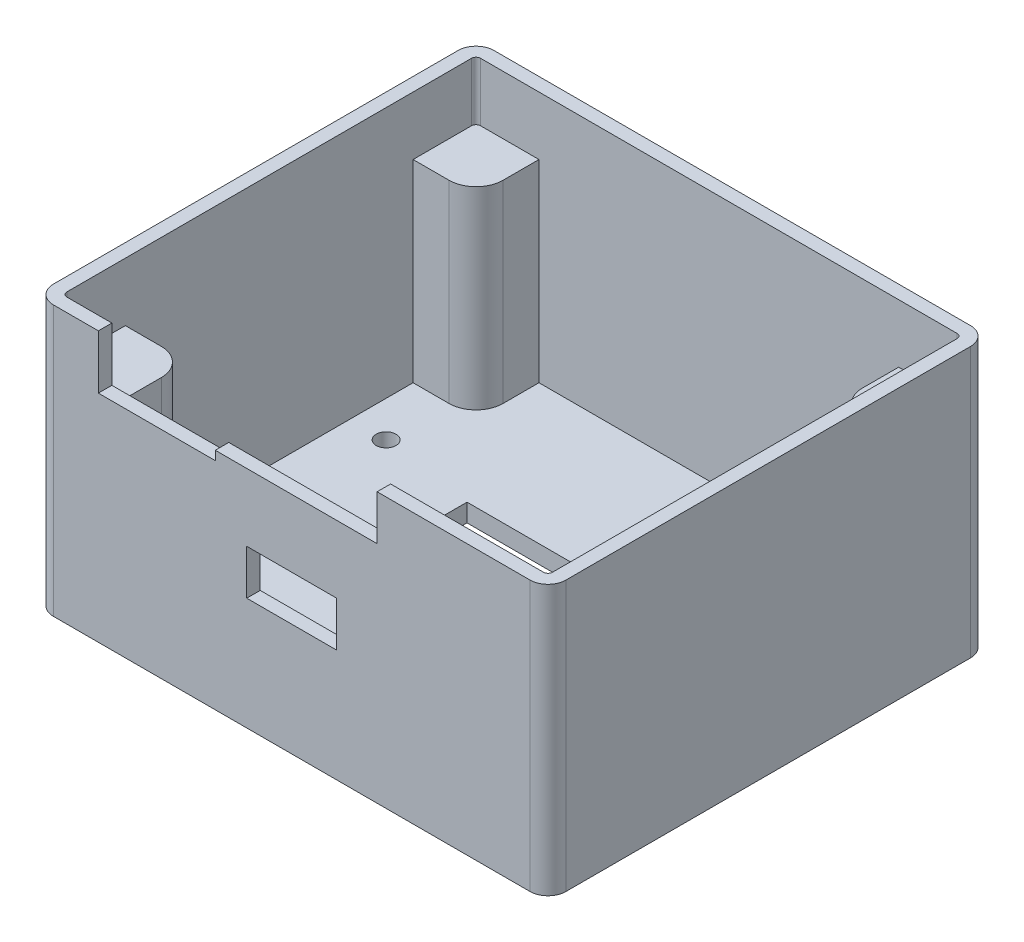
from build123d import *

# Parameters (mm, degrees)
EXTRUDE_1_DEPTH         = 30
CUT_EXTRUDE_1_DEPTH     = 28
EXTRUDE_START           = 21.5
EXTRUDE_2_DEPTH         = 21.5
CUT_EXTRUDE_2_DEPTH     = 1.5
HOLE_WIZARD_2_2_2_2_1_D = 2.2
CUT_EXTRUDE_3_REACH     = 48.867
SKETCH_7_W              = 25
SKETCH_7_H              = 15
CUT_EXTRUDE_4_REACH     = 66.135
SKETCH_8_W              = 10
SKETCH_8_H              = 5


with BuildPart() as part:
    # 草图1 → 凸台-拉伸1 (new body)
    with BuildSketch(Plane(origin=(0, 0, 0), x_dir=(1, 0, 0), z_dir=(0, 1, 0))):
        with BuildLine():
            Line((-26.5, -24.5), (26.5, -24.5))
            ThreePointArc((26.5, -24.5), (27.914213562, -23.914213562), (28.5, -22.5))
            Line((28.5, -22.5), (28.5, 22.5))
            ThreePointArc((28.5, 22.5), (27.914213562, 23.914213562), (26.5, 24.5))
            Line((26.5, 24.5), (-26.5, 24.5))
            ThreePointArc((-26.5, 24.5), (-27.914213562, 23.914213562), (-28.5, 22.5))
            Line((-28.5, 22.5), (-28.5, -22.5))
            ThreePointArc((-28.5, -22.5), (-27.914213562, -23.914213562), (-26.5, -24.5))
        make_face()
    extrude(amount=EXTRUDE_1_DEPTH)

    # 草图2 → 切除-拉伸1 (cut)
    with BuildSketch(Plane(origin=(0, 30, 0), x_dir=(1, 0, 0), z_dir=(0, 1, 0))):
        with BuildLine():
            Line((-26.5, -23), (26.5, -23))
            ThreePointArc((26.5, -23), (26.853553391, -22.853553391), (27, -22.5))
            Line((27, -22.5), (27, 22.5))
            ThreePointArc((27, 22.5), (26.853553391, 22.853553391), (26.5, 23))
            Line((26.5, 23), (-26.5, 23))
            ThreePointArc((-26.5, 23), (-26.853553391, 22.853553391), (-27, 22.5))
            Line((-27, 22.5), (-27, -22.5))
            ThreePointArc((-27, -22.5), (-26.853553391, -22.853553391), (-26.5, -23))
        make_face()
    extrude(amount=-CUT_EXTRUDE_1_DEPTH, mode=Mode.SUBTRACT)

    # 草图3 → 凸台-拉伸2 (add)
    with BuildSketch(Plane(origin=(0, 2, 0), x_dir=(1, 0, 0), z_dir=(0, 1, 0)).offset(EXTRUDE_START)):
        with BuildLine():
            Line((-27, -16), (-23, -16))
            ThreePointArc((-23, -16), (-20.878679656, -16.878679656), (-20, -19))
            Line((-20, -19), (-20, -23))
            Line((-20, -23), (-26.5, -23))
            ThreePointArc((-26.5, -23), (-26.853553391, -22.853553391), (-27, -22.5))
            Line((-27, -22.5), (-27, -16))
        make_face()
        with BuildLine():
            Line((-27, 16), (-23, 16))
            ThreePointArc((-23, 16), (-20.878679656, 16.878679656), (-20, 19))
            Line((-20, 19), (-20, 23))
            Line((-20, 23), (-26.5, 23))
            ThreePointArc((-26.5, 23), (-26.853553391, 22.853553391), (-27, 22.5))
            Line((-27, 22.5), (-27, 16))
        make_face()
        with BuildLine():
            Line((20, 23), (20, 19))
            ThreePointArc((20, 19), (20.878679656, 16.878679656), (23, 16))
            Line((23, 16), (27, 16))
            Line((27, 16), (27, 22.5))
            ThreePointArc((27, 22.5), (26.853553391, 22.853553391), (26.5, 23))
            Line((26.5, 23), (20, 23))
        make_face()
    extrude(amount=-EXTRUDE_2_DEPTH)

    # 草图4 → 切除-拉伸2 (cut)
    with BuildSketch(Plane.XY.offset(24.5)):
        Polygon((-21.5, 30), (9.5, 30), (9.5, 25), (-8.5, 25), (-8.5, 24), (-21.5, 24), align=None)
    extrude(amount=-CUT_EXTRUDE_2_DEPTH, mode=Mode.SUBTRACT)

    # Ø2.2 (2.2) 直径孔1 (through all)
    with Locations(Plane(origin=(0, 0, 0), x_dir=(-1, 0, 0), z_dir=(0, -1, 0))):
        with Locations((23, -9), (23, 9), (-23, -9), (-23, 9)):
            Hole(HOLE_WIZARD_2_2_2_2_1_D / 2)

    # 草图7 → 切除-拉伸3 (cut, up to next)
    with BuildSketch(Plane(origin=(0, 2, 0), x_dir=(1, 0, 0), z_dir=(0, 1, 0)), mode=Mode.PRIVATE) as cut_extrude_3_sk1:
        Rectangle(SKETCH_7_W, SKETCH_7_H)
    cut_extrude_3_tool1 = extrude(cut_extrude_3_sk1.sketch, amount=-CUT_EXTRUDE_3_REACH, mode=Mode.PRIVATE) & part.part
    add(cut_extrude_3_tool1.solids().sort_by_distance((0, 2, 0))[0], mode=Mode.SUBTRACT)

    # 草图8 → 切除-拉伸4 (cut, up to next)
    with BuildSketch(Plane.XY.offset(24.5), mode=Mode.PRIVATE) as cut_extrude_4_sk1:
        with Locations((0, 15)):
            Rectangle(SKETCH_8_W, SKETCH_8_H)
    cut_extrude_4_tool1 = extrude(cut_extrude_4_sk1.sketch, amount=-CUT_EXTRUDE_4_REACH, mode=Mode.PRIVATE) & part.part
    add(cut_extrude_4_tool1.solids().sort_by_distance((0, 15, 24.5))[0], mode=Mode.SUBTRACT)


solid = part.part
